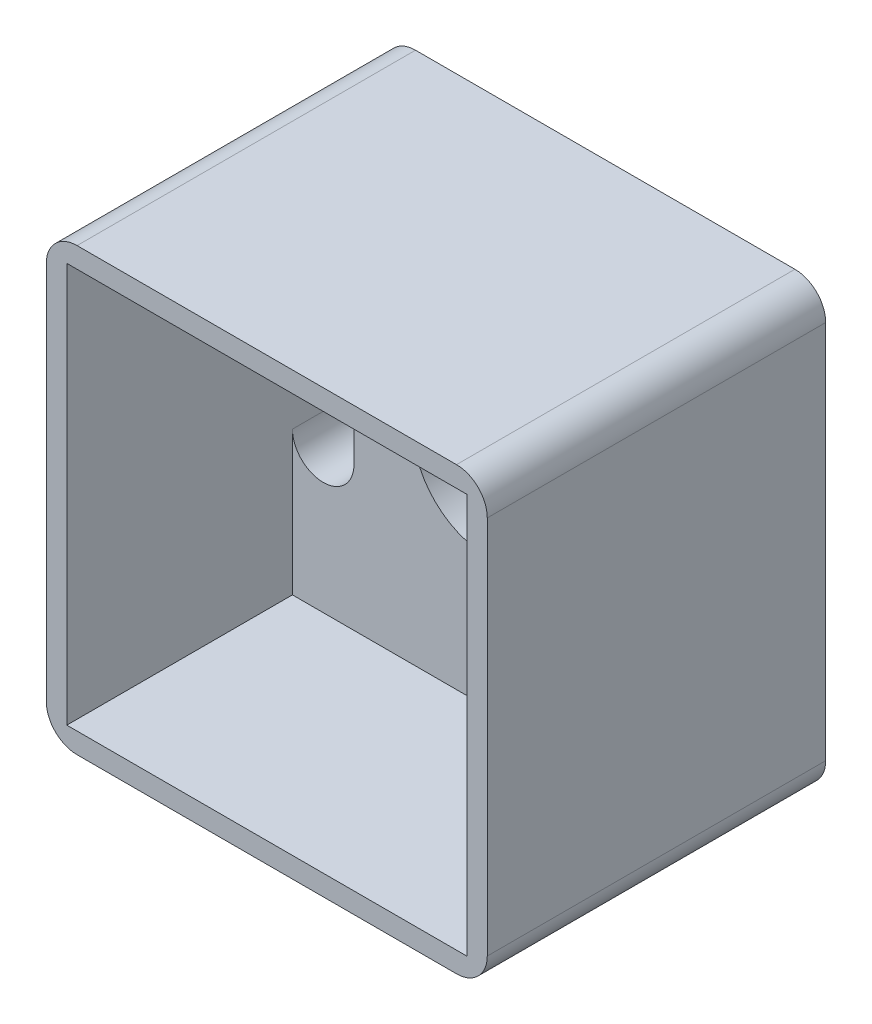
from build123d import *

# Parameters (mm, degrees)
SKETCH1_W           = 43
SKETCH1_H           = 43
BOSS_EXTRUDE1_DEPTH = 45
SKETCH3_R           = 3
SKETCH3_R_2         = 7.25
CUT_EXTRUDE4_DEPTH  = 38
SKETCH6_W           = 39
SKETCH6_H           = 39
CUT_EXTRUDE5_DEPTH  = 22
SKETCH7_W           = 43
SKETCH7_H           = 43
SKETCH7_W_2         = 18.4
SKETCH7_H_2         = 18.4
CUT_EXTRUDE8_DEPTH  = 12
FILLET2_R           = 5
FILLET3_R           = 3
SKETCH10_W          = 20.235048465
SKETCH10_H          = 19.323901817
CUT_EXTRUDE9_DEPTH  = 7


with BuildPart() as part:
    # Sketch1 → Boss-Extrude1 (new body)
    with BuildSketch(Plane(origin=(0, 0, 0), x_dir=(0, 1, 0), z_dir=(0, 0, 1))):
        with Locations((-19.5, 19.5)):
            Rectangle(SKETCH1_W, SKETCH1_H)
    extrude(amount=BOSS_EXTRUDE1_DEPTH)

    # Sketch3 → Cut-Extrude4 (cut)
    with BuildSketch(Plane.XY.offset(45)):
        with Locations((-20, -3.506761261)):
            Circle(SKETCH3_R)
        with Locations((-20, -19)):
            Circle(SKETCH3_R_2)
        with BuildLine():
            Line((-6, -13), (-6, -25))
            ThreePointArc((-6, -25), (-3, -28), (0, -25))
            Line((0, -25), (0, -13))
            ThreePointArc((0, -13), (-3, -10), (-6, -13))
        make_face()
        with BuildLine():
            Line((-33, -13), (-33, -25))
            ThreePointArc((-33, -25), (-36, -28), (-39, -25))
            Line((-39, -25), (-39, -13))
            ThreePointArc((-39, -13), (-36, -10), (-33, -13))
        make_face()
    extrude(amount=-CUT_EXTRUDE4_DEPTH, mode=Mode.SUBTRACT)

    # Sketch6 → Cut-Extrude5 (cut)
    with BuildSketch(Plane.XY.offset(45)):
        with Locations((-19.5, -19.5)):
            Rectangle(SKETCH6_W, SKETCH6_H)
    extrude(amount=-CUT_EXTRUDE5_DEPTH, mode=Mode.SUBTRACT)

    # Sketch7 → Cut-Extrude8 (cut)
    with BuildSketch(Plane(origin=(0, 0, 0), x_dir=(1, 0, 0), z_dir=(0, 0, -1))):
        with Locations((-19.5, 19.5)):
            Rectangle(SKETCH7_W, SKETCH7_H)
        with Locations((-20.012556467, 19.015852406)):
            Rectangle(SKETCH7_W_2, SKETCH7_H_2, mode=Mode.SUBTRACT)
    extrude(amount=-CUT_EXTRUDE8_DEPTH, mode=Mode.SUBTRACT)

    # Fillet2
    fillet2_edges = [part.edges().sort_by_distance(p)[0] for p in [
        (-10.812556467, -9.815852406, 6),
        (-10.812556467, -28.215852406, 6),
        (-29.212556467, -28.215852406, 6),
        (-29.212556467, -9.815852406, 6),
    ]]
    fillet(fillet2_edges, radius=FILLET2_R)

    # Fillet3
    fillet3_edges = [part.edges().sort_by_distance(p)[0] for p in [
        (-41, -41, 28.5),
        (2, -41, 28.5),
        (2, 2, 28.5),
        (-41, 2, 28.5),
    ]]
    fillet(fillet3_edges, radius=FILLET3_R)

    # Sketch10 → Cut-Extrude9 (cut)
    with BuildSketch(Plane(origin=(0, 0, 0), x_dir=(1, 0, 0), z_dir=(0, 0, -1))):
        with Locations((-19.898626658, 18.797657793)):
            Rectangle(SKETCH10_W, SKETCH10_H)
    extrude(amount=-CUT_EXTRUDE9_DEPTH, mode=Mode.SUBTRACT)


solid = part.part
